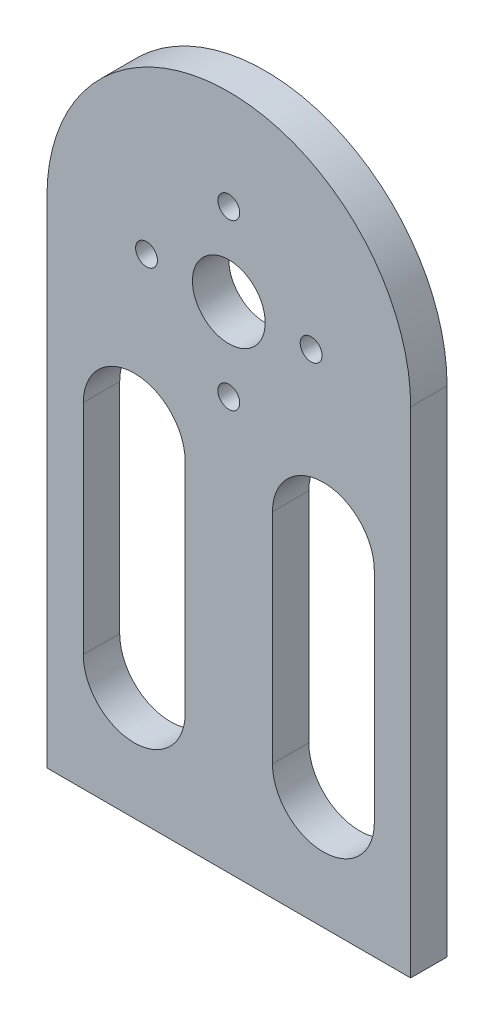
from build123d import *

# Parameters (mm, degrees)
SZKIC1_R                    = 2.5
SZKIC1_R_2                  = 0.75
DODANIE_WYCI_GNI_CIE1_DEPTH = 2.5


with BuildPart() as part:
    # Szkic1 → Dodanie-wyciągnięcie1 (new body)
    with BuildSketch(Plane.XY):
        with BuildLine():
            Line((-12.5, 34), (-12.5, 0))
            Line((-12.5, 0), (12.5, 0))
            Line((12.5, 0), (12.5, 34))
            ThreePointArc((12.5, 34), (0, 46.5), (-12.5, 34))
        make_face()
        with Locations((0, 34)):
            Circle(SZKIC1_R, mode=Mode.SUBTRACT)
        with Locations((0, 39.656854249)):
            Circle(SZKIC1_R_2, mode=Mode.SUBTRACT)
        with Locations((5.656854249, 34)):
            Circle(SZKIC1_R_2, mode=Mode.SUBTRACT)
        with Locations((0, 28.343145751)):
            Circle(SZKIC1_R_2, mode=Mode.SUBTRACT)
        with Locations((-5.656854249, 34)):
            Circle(SZKIC1_R_2, mode=Mode.SUBTRACT)
        with BuildLine():
            Line((-3, 23), (-3, 8))
            ThreePointArc((-3, 8), (-6.5, 4.5), (-10, 8))
            Line((-10, 8), (-10, 23))
            ThreePointArc((-10, 23), (-6.5, 26.5), (-3, 23))
        make_face(mode=Mode.SUBTRACT)
        with BuildLine():
            Line((3, 23), (3, 8))
            ThreePointArc((3, 8), (6.5, 4.5), (10, 8))
            Line((10, 8), (10, 23))
            ThreePointArc((10, 23), (6.5, 26.5), (3, 23))
        make_face(mode=Mode.SUBTRACT)
    extrude(amount=DODANIE_WYCI_GNI_CIE1_DEPTH)


solid = part.part
